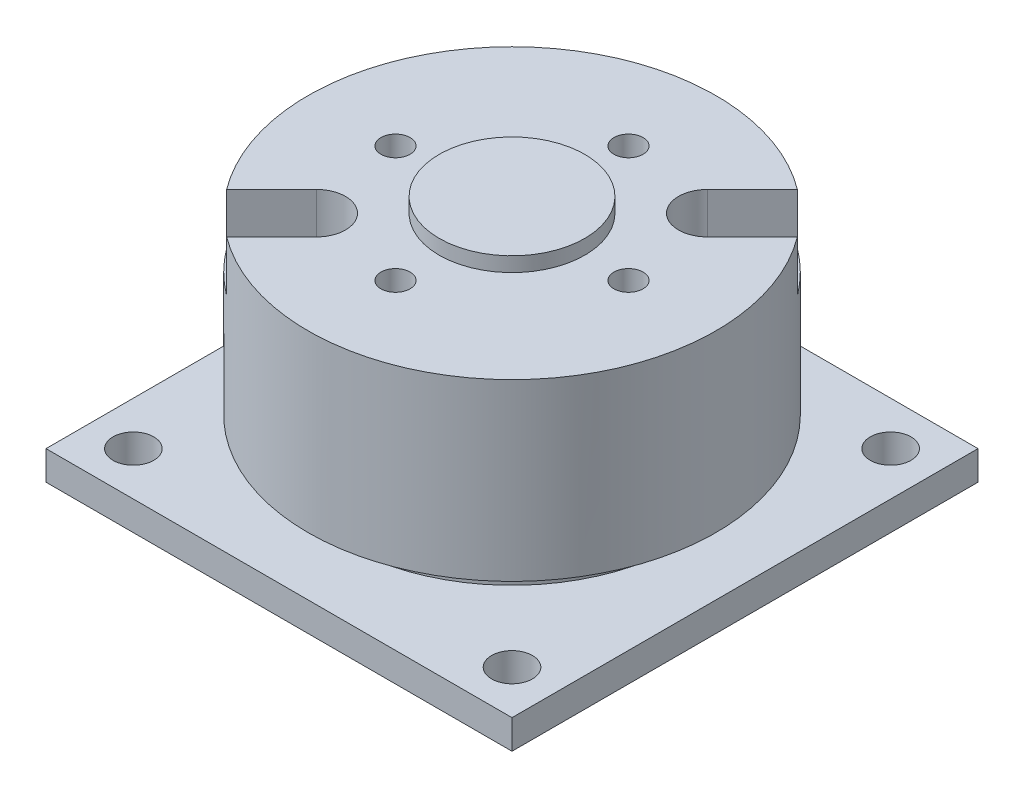
from build123d import *

# Parameters (mm, degrees)
SKETCH_1_R          = 11.5
SKETCH_1_R_2        = 1
EXTRUDE_1_DEPTH     = 2
SKETCH_1_3_R        = 5
EXTRUDE_2_DEPTH     = 0.25
SKETCH_2_R          = 14
EXTRUDE_3_DEPTH     = 12
EXTRUDE_START       = 1
SKETCH_3_R          = 5
EXTRUDE_4_DEPTH     = 1
CUT_EXTRUDE_START   = -10
SKETCH_3_3_R        = 1
CUT_EXTRUDE_1_DEPTH = 10
CUT_EXTRUDE_2_DEPTH = 3.5
SKETCH_5_W          = 32
SKETCH_5_H          = 32
SKETCH_5_R          = 1.4
EXTRUDE_5_DEPTH     = 2
EXTRUDE_START_2     = 2
SKETCH_6_R          = 1
EXTRUDE_6_DEPTH     = 2
SKETCH_7_W          = 20
SKETCH_7_H          = 20
SKETCH_7_R          = 1.6
EXTRUDE_7_DEPTH     = 1.7


with BuildPart() as part:
    # 草图1 → 凸台-拉伸1 (new body)
    with BuildSketch(Plane(origin=(0, 0, 0), x_dir=(1, 0, 0), z_dir=(0, 1, 0))):
        Circle(SKETCH_1_R)
        with Locations((0, -8)):
            Circle(SKETCH_1_R_2, mode=Mode.SUBTRACT)
        with Locations((-8, 0)):
            Circle(SKETCH_1_R_2, mode=Mode.SUBTRACT)
        with Locations((8, 0)):
            Circle(SKETCH_1_R_2, mode=Mode.SUBTRACT)
        with Locations((0, 8)):
            Circle(SKETCH_1_R_2, mode=Mode.SUBTRACT)
    extrude(amount=EXTRUDE_1_DEPTH)

    # 草图1<3> → 凸台-拉伸2 (add)
    with BuildSketch(Plane(origin=(0, 0, 0), x_dir=(1, 0, 0), z_dir=(0, 1, 0))):
        Circle(SKETCH_1_3_R)
    extrude(amount=-EXTRUDE_2_DEPTH)

    # 草图2 → 凸台-拉伸3 (add)
    with BuildSketch(Plane(origin=(0, 2, 0), x_dir=(1, 0, 0), z_dir=(0, 1, 0))):
        Circle(SKETCH_2_R)
    extrude(amount=EXTRUDE_3_DEPTH)

    # 草图3 → 凸台-拉伸4 (add)
    with BuildSketch(Plane(origin=(0, 14, 0), x_dir=(1, 0, 0), z_dir=(0, 1, 0)).offset(EXTRUDE_START)):
        Circle(SKETCH_3_R)
    extrude(amount=-EXTRUDE_4_DEPTH)

    # 草图3<3> → 切除-拉伸1 (cut)
    with BuildSketch(Plane(origin=(0, 14, 0), x_dir=(1, 0, 0), z_dir=(0, 1, 0)).offset(CUT_EXTRUDE_START)):
        with Locations((8, 0)):
            Circle(SKETCH_3_3_R)
        with Locations((0, -8)):
            Circle(SKETCH_3_3_R)
        with Locations((-8, 0)):
            Circle(SKETCH_3_3_R)
        with Locations((0, 8)):
            Circle(SKETCH_3_3_R)
    extrude(amount=CUT_EXTRUDE_1_DEPTH, mode=Mode.SUBTRACT)

    # 草图4 → 切除-拉伸2 (cut)
    with BuildSketch(Plane(origin=(0, 14, 0), x_dir=(1, 0, 0), z_dir=(0, 1, 0))):
        with BuildLine():
            Line((14.495689014, 11.66726189), (8.131727984, 5.303300859))
            ThreePointArc((8.131727984, 5.303300859), (5.303300859, 5.303300859), (5.303300859, 8.131727984))
            Line((5.303300859, 8.131727984), (11.66726189, 14.495689014))
            ThreePointArc((11.66726189, 14.495689014), (14.495689014, 14.495689014), (14.495689014, 11.66726189))
        make_face()
        with BuildLine():
            Line((-11.66726189, -14.495689014), (-5.303300859, -8.131727984))
            ThreePointArc((-5.303300859, -8.131727984), (-5.303300859, -5.303300859), (-8.131727984, -5.303300859))
            Line((-8.131727984, -5.303300859), (-14.495689014, -11.66726189))
            ThreePointArc((-14.495689014, -11.66726189), (-14.495689014, -14.495689014), (-11.66726189, -14.495689014))
        make_face()
    extrude(amount=-CUT_EXTRUDE_2_DEPTH, mode=Mode.SUBTRACT)

    # 草图5 → 凸台-拉伸5 (add)
    with BuildSketch(Plane.XZ):
        Rectangle(SKETCH_5_W, SKETCH_5_H)
        with Locations((13, 13)):
            Circle(SKETCH_5_R, mode=Mode.SUBTRACT)
        with Locations((-13, 13)):
            Circle(SKETCH_5_R, mode=Mode.SUBTRACT)
        with Locations((13, -13)):
            Circle(SKETCH_5_R, mode=Mode.SUBTRACT)
        with Locations((-13, -13)):
            Circle(SKETCH_5_R, mode=Mode.SUBTRACT)
    extrude(amount=EXTRUDE_5_DEPTH)

    # 草图6 → 凸台-拉伸6 (add)
    with BuildSketch(Plane.XZ.offset(2).offset(EXTRUDE_START_2)):
        with Locations((8, 0)):
            Circle(SKETCH_6_R)
        with Locations((0, -8)):
            Circle(SKETCH_6_R)
        with Locations((-8, 0)):
            Circle(SKETCH_6_R)
        with Locations((0, 8)):
            Circle(SKETCH_6_R)
    extrude(amount=-EXTRUDE_6_DEPTH)

    # 草图7 → 凸台-拉伸7 (add)
    with BuildSketch(Plane.XZ.offset(4)):
        Rectangle(SKETCH_7_W, SKETCH_7_H)
        with Locations((7, 7)):
            Circle(SKETCH_7_R, mode=Mode.SUBTRACT)
        with Locations((-7, 7)):
            Circle(SKETCH_7_R, mode=Mode.SUBTRACT)
        with Locations((7, -7)):
            Circle(SKETCH_7_R, mode=Mode.SUBTRACT)
        with Locations((-7, -7)):
            Circle(SKETCH_7_R, mode=Mode.SUBTRACT)
    extrude(amount=EXTRUDE_7_DEPTH)


solid = part.part
